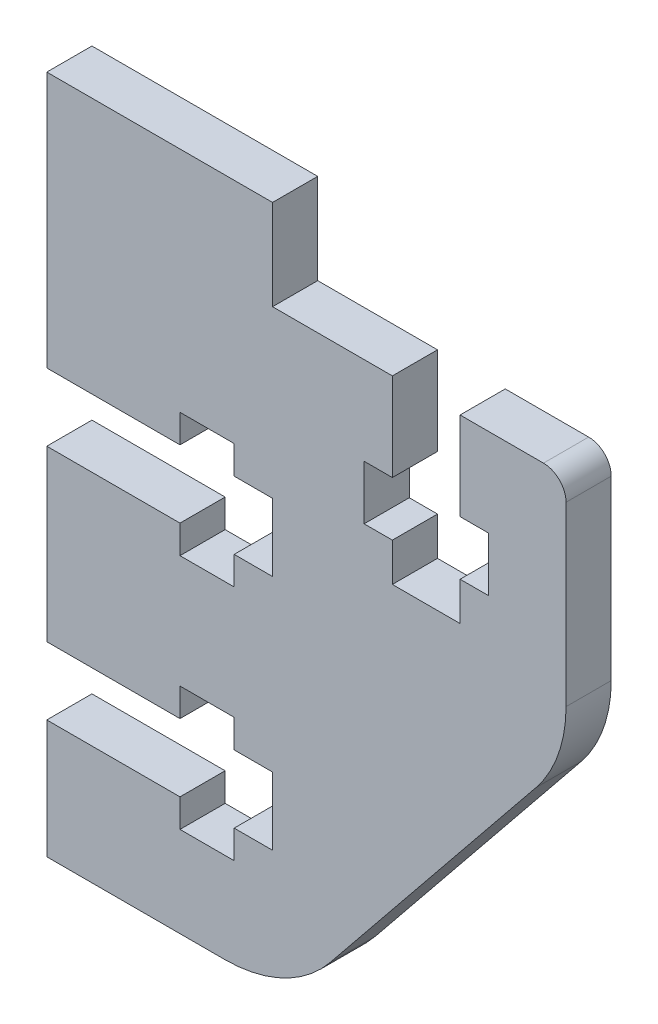
from build123d import *

# Parameters (mm, degrees)
BOSS_EXTRUDE1_DEPTH = 2


with BuildPart() as part:
    # Model → Boss-Extrude1 (new body)
    with BuildSketch(Plane.XY):
        with BuildLine():
            Line((2144.94220094, 1193.448627523), (2143.24220094, 1193.448627523))
            Line((2143.24220094, 1193.448627523), (2143.24220094, 1192.198627523))
            Line((2143.24220094, 1192.198627523), (2140.84220094, 1192.198627523))
            Line((2140.84220094, 1192.198627523), (2140.84220094, 1193.448627523))
            Line((2140.84220094, 1193.448627523), (2134.94220094, 1193.448627523))
            Line((2134.94220094, 1193.448627523), (2134.94220094, 1188.198627523))
            Line((2134.94220094, 1188.198627523), (2142.830690909, 1188.198627523))
            ThreePointArc((2142.830690909, 1188.198627523), (2145.414681766, 1188.783556771), (2147.494855348, 1190.424297107))
            Line((2147.494855348, 1190.424297107), (2156.606365378, 1201.683931632))
            ThreePointArc((2156.606365378, 1201.683931632), (2157.598391647, 1203.456386257), (2157.94220094, 1205.458262048))
            Line((2157.94220094, 1205.458262048), (2157.94220094, 1213.298627523))
            ThreePointArc((2157.94220094, 1213.298627523), (2157.649307721, 1214.005734304), (2156.94220094, 1214.298627523))
            Line((2156.94220094, 1214.298627523), (2153.248219276, 1214.298627523))
            Line((2153.248219276, 1214.298627523), (2153.248219276, 1210.398627523))
            Line((2153.248219276, 1210.398627523), (2154.498219276, 1210.398627523))
            Line((2154.498219276, 1210.398627523), (2154.498219276, 1207.998627523))
            Line((2154.498219276, 1207.998627523), (2153.248219276, 1207.998627523))
            Line((2153.248219276, 1207.998627523), (2153.248219276, 1206.298627523))
            Line((2153.248219276, 1206.298627523), (2150.248219276, 1206.298627523))
            Line((2150.248219276, 1206.298627523), (2150.248219276, 1207.998627523))
            Line((2150.248219276, 1207.998627523), (2148.998219276, 1207.998627523))
            Line((2148.998219276, 1207.998627523), (2148.998219276, 1210.398627523))
            Line((2148.998219276, 1210.398627523), (2150.248219276, 1210.398627523))
            Line((2150.248219276, 1210.398627523), (2150.248219276, 1214.298627523))
            Line((2150.248219276, 1214.298627523), (2144.94220094, 1214.298627523))
            Line((2144.94220094, 1214.298627523), (2144.94220094, 1218.298627523))
            Line((2144.94220094, 1218.298627523), (2134.94220094, 1218.298627523))
            Line((2134.94220094, 1218.298627523), (2134.94220094, 1206.948627523))
            Line((2134.94220094, 1206.948627523), (2140.84220094, 1206.948627523))
            Line((2140.84220094, 1206.948627523), (2140.84220094, 1208.198627523))
            Line((2140.84220094, 1208.198627523), (2143.24220094, 1208.198627523))
            Line((2143.24220094, 1208.198627523), (2143.24220094, 1206.948627523))
            Line((2143.24220094, 1206.948627523), (2144.94220094, 1206.948627523))
            Line((2144.94220094, 1206.948627523), (2144.94220094, 1203.948627523))
            Line((2144.94220094, 1203.948627523), (2143.24220094, 1203.948627523))
            Line((2143.24220094, 1203.948627523), (2143.24220094, 1202.698627523))
            Line((2143.24220094, 1202.698627523), (2140.84220094, 1202.698627523))
            Line((2140.84220094, 1202.698627523), (2140.84220094, 1203.948627523))
            Line((2140.84220094, 1203.948627523), (2134.94220094, 1203.948627523))
            Line((2134.94220094, 1203.948627523), (2134.94220094, 1196.448627523))
            Line((2134.94220094, 1196.448627523), (2140.84220094, 1196.448627523))
            Line((2140.84220094, 1196.448627523), (2140.84220094, 1197.698627523))
            Line((2140.84220094, 1197.698627523), (2143.24220094, 1197.698627523))
            Line((2143.24220094, 1197.698627523), (2143.24220094, 1196.448627523))
            Line((2143.24220094, 1196.448627523), (2144.94220094, 1196.448627523))
            Line((2144.94220094, 1196.448627523), (2144.94220094, 1193.448627523))
        make_face()
    extrude(amount=BOSS_EXTRUDE1_DEPTH)


solid = part.part
